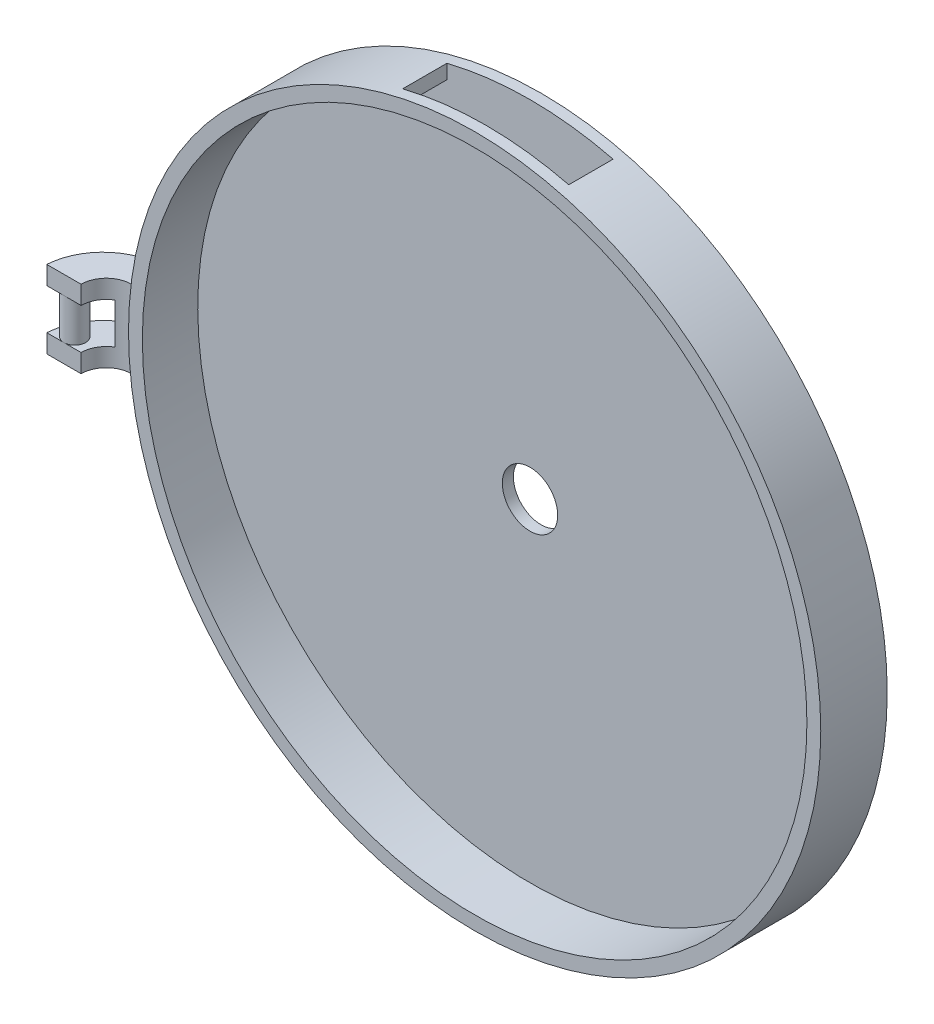
from build123d import *

# Parameters (mm, degrees)
SKETCH1_R                 = 79.375
BOSS_EXTRUDE1_DEPTH       = 15.24
SKETCH3_R                 = 76.2
CUT_EXTRUDE1_DEPTH        = 12.7
CUT_EXTRUDE2_REACH        = 127.983
CUT_EXTRUDE2_START_RADIUS = 79.375
CUT_EXTRUDE2_END_RADIUS   = 79.375
SKETCH4_W                 = 38.1
SKETCH4_H                 = 10.16
BOSS_EXTRUDE4_DEPTH       = 8.89
SKETCH12_W                = 4.966607372
SKETCH12_H                = 9.339535176
CUT_EXTRUDE4_DEPTH        = 127
SKETCH14_W                = 9.418394458
SKETCH14_H                = 9.339535176
CUT_EXTRUDE5_DEPTH        = 12.7
SKETCH17_R                = 2.483303686
BOSS_EXTRUDE5_DEPTH       = 12.7
CUT_EXTRUDE6_REACH        = 126.038
SKETCH18_R                = 6.35


with BuildPart() as part:
    # Sketch1 → Boss-Extrude1 (new body)
    with BuildSketch(Plane.XY):
        with Locations(Location((0, 0, 0), (0, 0, 180))):
            Circle(SKETCH1_R)
    extrude(amount=BOSS_EXTRUDE1_DEPTH)

    # Sketch3 → Cut-Extrude1 (cut)
    with BuildSketch(Plane.XY.offset(15.24)):
        Circle(SKETCH3_R)
    extrude(amount=-CUT_EXTRUDE1_DEPTH, mode=Mode.SUBTRACT)

    # Cut-Extrude2: from a cylinder face, 127.983 long prism both ways, kept between that surface and its translate by the depth
    cut_extrude2_start = Plane(origin=(0, 0, 7.62), z_dir=(0, 0, -1)) * Cylinder(CUT_EXTRUDE2_START_RADIUS, 415.716, mode=Mode.PRIVATE)
    cut_extrude2_end = Plane(origin=(0, -12.7, 7.62), z_dir=(0, 0, -1)) * Cylinder(CUT_EXTRUDE2_END_RADIUS, 415.716, mode=Mode.PRIVATE)
    # Sketch4 → Cut-Extrude2 (cut, from a surface)
    with BuildSketch(Plane(origin=(0, 0, 0), x_dir=(1, 0, 0), z_dir=(0, 1, 0)), mode=Mode.PRIVATE) as cut_extrude2_sk1:
        with Locations((0, -7.62)):
            Rectangle(SKETCH4_W, SKETCH4_H)
    cut_extrude2_tool1 = extrude(cut_extrude2_sk1.sketch, amount=CUT_EXTRUDE2_REACH, both=True, mode=Mode.PRIVATE)
    add(((cut_extrude2_tool1 & cut_extrude2_start) - cut_extrude2_end).solids().sort_by_distance((0, 75.417715, 7.62))[0], mode=Mode.SUBTRACT)

    # Sketch10 → Boss-Extrude4 (add, symmetric)
    with BuildSketch(Plane(origin=(0, 0, 0), x_dir=(1, 0, 0), z_dir=(0, 1, 0))):
        with BuildLine():
            Line((-79.375, -7.291478714), (-76.524780006, -7.291478714))
            Line((-76.524780006, -7.291478714), (-76.524780006, -15.24))
            ThreePointArc((-76.524780006, -15.24), (-82.346061619, -15.175676783), (-85.275429215, -20.206607372))
            Line((-85.275429215, -20.206607372), (-93.149429215, -20.206607372))
            ThreePointArc((-93.149429215, -20.206607372), (-88.816073144, -11.025265017), (-79.375, -7.291478714))
        make_face()
    extrude(amount=BOSS_EXTRUDE4_DEPTH, both=True)

    # Sketch12 → Cut-Extrude4 (cut)
    with BuildSketch(Plane(origin=(0, 0, 0), x_dir=(0, 0, -1), z_dir=(1, 0, 0))):
        with Locations((-17.723303686, 0)):
            Rectangle(SKETCH12_W, SKETCH12_H)
    extrude(amount=-CUT_EXTRUDE4_DEPTH, mode=Mode.SUBTRACT)

    # Sketch14 → Cut-Extrude5 (cut)
    with BuildSketch(Plane.XY.offset(15.24)):
        with Locations((-87.165728303, 0)):
            Rectangle(SKETCH14_W, SKETCH14_H)
    extrude(amount=-CUT_EXTRUDE5_DEPTH, mode=Mode.SUBTRACT)

    # Sketch17 → Boss-Extrude5 (add)
    with BuildSketch(Plane.XZ.offset(-4.669767588)):
        with Locations(Location((-89.212429215, 17.723303686, 0), (0, 0, 90))):
            Circle(SKETCH17_R)
    extrude(amount=BOSS_EXTRUDE5_DEPTH)

    # Sketch18 → Cut-Extrude6 (cut, up to next)
    with BuildSketch(Plane(origin=(0, 0, 0), x_dir=(-1, 0, 0), z_dir=(0, 0, -1)), mode=Mode.PRIVATE) as cut_extrude6_sk1:
        Circle(SKETCH18_R)
    cut_extrude6_tool1 = extrude(cut_extrude6_sk1.sketch, amount=-CUT_EXTRUDE6_REACH, mode=Mode.PRIVATE) & part.part
    add(cut_extrude6_tool1.solids().sort_by_distance((0, 0, 0))[0], mode=Mode.SUBTRACT)


solid = part.part
